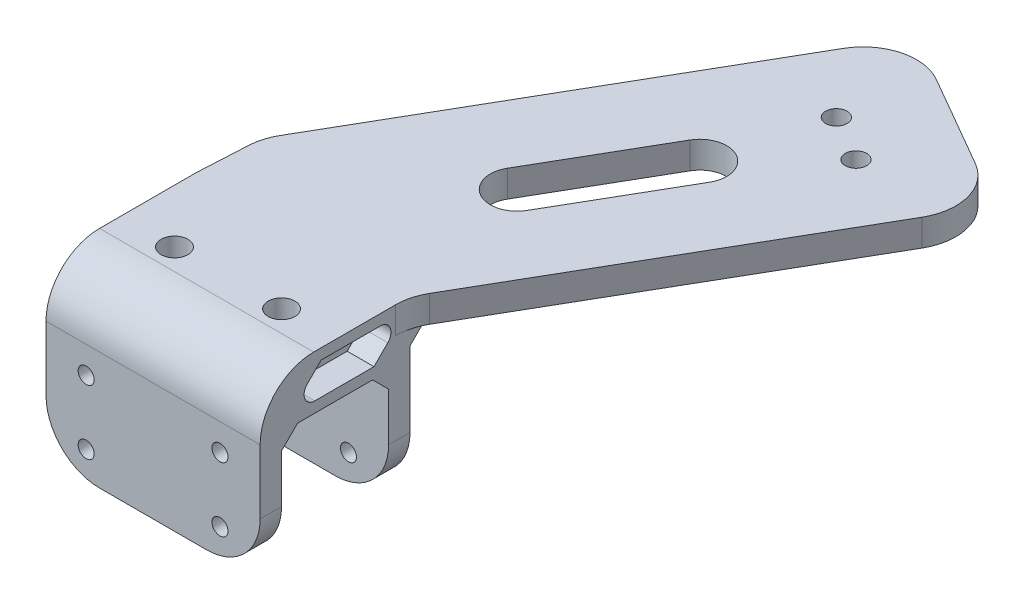
from build123d import *

# Parameters (mm, degrees)
EXTRUDE_1_DEPTH      = 10
SKETCH_2_W           = 40
SKETCH_2_H           = 4
SKETCH_2_H_2         = 3.9999999999999982
EXTRUDE_2_DEPTH      = 10
SKETCH_4_W           = 40
SKETCH_4_H           = 5
EXTRUDE_3_DEPTH      = 15
SKETCH_6_W           = 40
SKETCH_6_H           = 5
EXTRUDE_4_DEPTH      = 15
SKETCH_8_R           = 2.5000000000000004
CUT_EXTRUDE_2_DEPTH  = 15
CHAMFER_1_SIZE       = 3
FILLET_1_R           = 10
CHAMFER_2_SIZE       = 3
SKETCH_9_R           = 1.5000000000000007
CUT_EXTRUDE_3_DEPTH  = 38.41657386773942
CUT_EXTRUDE_4_DEPTH  = 5
FILLET_3_R           = 2
SKETCH_11_W          = 40
SKETCH_11_H          = 6.999999999999998
SKETCH_11_H_2        = 7
EXTRUDE_5_DEPTH      = 3
CHAMFER_3_SIZE       = 1
SKETCH_12_W          = 40
SKETCH_12_H          = 5
EXTRUDE_6_DEPTH      = 30
FILLET_4_R           = 10
SKETCH_13_R          = 2
SKETCH_13_R_2        = 2.0000000000000027
CUT_EXTRUDE_5_DEPTH  = 30
EXTRUDE_START        = -5
EXTRUDE_7_DEPTH      = 5
CUT_EXTRUDE_6_DEPTH  = 5
SKETCH_16_W          = 20.000000000000007
SKETCH_16_H          = 9.517030698893077
CUT_EXTRUDE_7_DEPTH  = 122.15395545343927
SKETCH_17_W          = 40
SKETCH_17_H          = 3.9999999999999982
SKETCH_17_H_2        = 4
EXTRUDE_8_DEPTH      = 12
SKETCH_18_R          = 1.5000000000000007
SKETCH_18_R_2        = 1.5000000000000009
CUT_EXTRUDE_8_DEPTH  = 124.72425272933131
SKETCH_19_R          = 2.0000000000000067
SKETCH_19_R_2        = 2.0000000000000036
CUT_EXTRUDE_9_DEPTH  = 115.02754457592229
CUT_EXTRUDE_10_DEPTH = 115.02754457592229
EXTRUDE_9_DEPTH      = 5
SKETCH_23_R          = 2.0000000000000036
SKETCH_23_R_2        = 2.0000000000000067
CUT_EXTRUDE_11_DEPTH = 115.0275445759223
SKETCH_24_R          = 2.0000000000000067
SKETCH_24_R_2        = 2.0000000000000036
CUT_EXTRUDE_12_DEPTH = 115.02754457592229
CUT_EXTRUDE_13_DEPTH = 115.02754457592229
SKETCH_26_W          = 40
SKETCH_26_H          = 5
EXTRUDE_10_DEPTH     = 10
FILLET_6_R           = 10


with BuildPart() as part:
    # 草图1 → 凸台-拉伸1 (new body)
    with BuildSketch(Plane(origin=(0, 0, 0), x_dir=(1, 0, 0), z_dir=(0, 1, 0))):
        Polygon((20.000000000000004, 14.000000000000007), (-19.999999999999996, 14.000000000000002), (-19.999999999999996, -13.999999999999998), (20.000000000000004, -13.999999999999993), align=None)
    extrude(amount=EXTRUDE_1_DEPTH)

    # 草图2 → 凸台-拉伸2 (add)
    with BuildSketch(Plane.XZ):
        with Locations((3.55e-15, 11.999999999999998)):
            Rectangle(SKETCH_2_W, SKETCH_2_H)
        with Locations((3.55e-15, -12.000000000000007)):
            Rectangle(SKETCH_2_W, SKETCH_2_H_2)
    extrude(amount=EXTRUDE_2_DEPTH)

    # 草图4 → 凸台-拉伸3 (add)
    with BuildSketch(Plane(origin=(-1.82e-15, 0, -14.000000000000004), x_dir=(-1, 0, 1.3e-16), z_dir=(-1.3e-16, 0, -1))):
        with Locations((-7.11e-15, 7.5)):
            Rectangle(SKETCH_4_W, SKETCH_4_H)
    extrude(amount=EXTRUDE_3_DEPTH)

    # 草图6 → 凸台-拉伸4 (add)
    with BuildSketch(Plane(origin=(-3.77e-15, 0, -29.000000000000004), x_dir=(-1, 0, 1.3e-16), z_dir=(-1.3e-16, 0, -1))):
        with Locations((-3.55e-15, 7.5)):
            Rectangle(SKETCH_6_W, SKETCH_6_H)
    extrude(amount=EXTRUDE_4_DEPTH)

    # 草图8 → 切除-拉伸2 (cut)
    with BuildSketch(Plane(origin=(0, 10, 0), x_dir=(1, 0, 0), z_dir=(0, 1, 0))):
        with Locations(Location((-10.000000000000004, 1.73e-15, 0), (0, 0, 270))):
            Circle(SKETCH_8_R)
        with Locations(Location((10.000000000000002, 1.73e-15, 0), (0, 0, 270))):
            Circle(SKETCH_8_R)
    extrude(amount=-CUT_EXTRUDE_2_DEPTH, mode=Mode.SUBTRACT)

    # 倒角1
    chamfer_1_edges = [part.edges().sort_by_distance(p)[0] for p in [
        (3.55e-15, 0, 9.999999999999998),
        (3.55e-15, 0, -10.000000000000007),
    ]]
    chamfer(chamfer_1_edges, length=CHAMFER_1_SIZE)

    # 圆角1
    fillet_1_edges = [part.edges().sort_by_distance(p)[0] for p in [
        (3.55e-15, 10, 13.999999999999996),
    ]]
    fillet(fillet_1_edges, radius=FILLET_1_R)

    # 倒角2
    chamfer_2_edges = [part.edges().sort_by_distance(p)[0] for p in [
        (5.28e-15, 5, -14.000000000000004),
    ]]
    chamfer(chamfer_2_edges, length=CHAMFER_2_SIZE)

    # 草图9 → 切除-拉伸3 (cut, through all)
    with BuildSketch(Plane(origin=(-1.82e-15, 0, -14.000000000000004), x_dir=(-1, 0, 1.3e-16), z_dir=(-1.3e-16, 0, -1))):
        with Locations((-12.500000000000007, -5)):
            Circle(SKETCH_9_R)
        with Locations((12.499999999999993, -5)):
            Circle(SKETCH_9_R)
    extrude(amount=-CUT_EXTRUDE_3_DEPTH, mode=Mode.SUBTRACT)

    # 草图10 → 切除-拉伸4 (cut)
    with BuildSketch(Plane(origin=(20.000000000000004, 0, 0), x_dir=(0, 0, -1), z_dir=(1, 0, 0))):
        Polygon((-2.6185414170321746, 7.999999999999998), (-8.618541417032173, 2), (7.26407194166772, 2), (13.264071941667716, 8), align=None)
    cut_extrude_4 = extrude(amount=-CUT_EXTRUDE_4_DEPTH, mode=Mode.SUBTRACT)

    # 圆角3
    fillet_3_edges = [part.edges().sort_by_distance(p)[0] for p in [
        (17.500000000000004, 8, -13.264071941667716),
        (17.500000000000004, 2, 8.618541417032173),
    ]]
    fillet(fillet_3_edges, radius=FILLET_3_R)

    # 镜向1: 切除-拉伸4 across plane
    add(cut_extrude_4.mirror(Plane(origin=(0, 0, 0), x_dir=(0, 0, 1), z_dir=(1, 0, 0))), mode=Mode.SUBTRACT)

    # 草图11 → 凸台-拉伸5 (add)
    with BuildSketch(Plane.XZ.offset(10)):
        with Locations((3.55e-15, -10.500000000000007)):
            Rectangle(SKETCH_11_W, SKETCH_11_H)
        with Locations((3.55e-15, 10.499999999999998)):
            Rectangle(SKETCH_11_W, SKETCH_11_H_2)
    extrude(amount=-EXTRUDE_5_DEPTH)

    # 倒角3
    chamfer_3_edges = [part.edges().sort_by_distance(p)[0] for p in [
        (3.55e-15, -7, -7.000000000000007),
        (3.55e-15, -7, 6.999999999999998),
    ]]
    chamfer(chamfer_3_edges, length=CHAMFER_3_SIZE)

    # 草图12 → 凸台-拉伸6 (add)
    with BuildSketch(Plane(origin=(-7.63e-15, 0, -44.00000000000001), x_dir=(-1, 0, 1.7e-16), z_dir=(-1.7e-16, 0, -1))):
        with Locations((-3.55e-15, 7.5)):
            Rectangle(SKETCH_12_W, SKETCH_12_H)
    extrude(amount=EXTRUDE_6_DEPTH)

    # 圆角4
    fillet_4_edges = [part.edges().sort_by_distance(p)[0] for p in [
        (19.99999999999999, 7.5, -74),
        (-20.00000000000001, 7.5, -74),
    ]]
    fillet(fillet_4_edges, radius=FILLET_4_R)

    # 草图13 → 切除-拉伸5 (cut)
    with BuildSketch(Plane(origin=(0, 10, 0), x_dir=(1, 0, 0), z_dir=(0, 1, 0))):
        with Locations(Location((9.140000000000004, 70, 0), (0, 0, 270))):
            Circle(SKETCH_13_R)
        with Locations(Location((-0.8599999999999962, 70.00000000000001, 0), (0, 0, 270))):
            Circle(SKETCH_13_R_2)
    extrude(amount=-CUT_EXTRUDE_5_DEPTH, mode=Mode.SUBTRACT)

    # 草图14 → 凸台-拉伸7 (add)
    with BuildSketch(Plane(origin=(0, 10, 0), x_dir=(1, 0, 0), z_dir=(0, 1, 0)).offset(EXTRUDE_START)):
        with BuildLine():
            Line((-19.999999999999996, 64.00000000000001), (-19.999999999999996, 14.000000000000007))
            Line((-19.999999999999996, 14.000000000000007), (20.000000000000004, 14.000000000000007))
            Line((20.000000000000004, 14.000000000000007), (20.000000000000004, 24.71796769724495))
            Line((20.000000000000004, 24.717967697244944), (-8.452994616207512, 74.00000000000003))
            Line((-8.45299461620751, 74.00000000000001), (-9.999999999999998, 74.00000000000001))
            ThreePointArc((-9.999999999999998, 74.00000000000001), (-17.071067811865472, 71.07106781186549), (-19.999999999999996, 64.00000000000001))
        make_face()
        with BuildLine():
            Line((-55.00000000000003, 74.62177826491072), (-19.999999999999996, 14.000000000000007))
            Line((-19.999999999999996, 14.000000000000007), (-19.999999999999996, 64.00000000000001))
            ThreePointArc((-19.999999999999996, 64.00000000000001), (-17.071067811865472, 71.07106781186549), (-9.999999999999998, 74.00000000000001))
            Line((-9.999999999999998, 74.00000000000001), (-8.45299461620751, 74.00000000000001))
            Line((-8.452994616207512, 74.00000000000003), (-20.35898384862252, 94.62177826491077))
            Line((-20.35898384862252, 94.62177826491077), (-55.000000000000014, 74.62177826491072))
        make_face()
    extrude(amount=EXTRUDE_7_DEPTH)

    # 草图15 → 切除-拉伸6 (cut)
    with BuildSketch(Plane(origin=(0, 10, 0), x_dir=(1, 0, 0), z_dir=(0, 1, 0))):
        Polygon((-8.452994616207489, 74.00000000000001), (20.000000000000004, 24.717967697244916), (20.000000000000004, 77.52110183518307), align=None)
    extrude(amount=-CUT_EXTRUDE_6_DEPTH, mode=Mode.SUBTRACT)

    # 草图16 → 切除-拉伸7 (cut, through all)
    with BuildSketch(Plane(origin=(20.000000000000004, 0, 0), x_dir=(0, 0, -1), z_dir=(1, 0, 0))):
        with Locations((4.44e-15, -11.758515349446538)):
            Rectangle(SKETCH_16_W, SKETCH_16_H)
    extrude(amount=-CUT_EXTRUDE_7_DEPTH, mode=Mode.SUBTRACT)

    # 草图17 → 凸台-拉伸8 (add)
    with BuildSketch(Plane.XZ.offset(10)):
        with Locations((3.55e-15, -12.000000000000007)):
            Rectangle(SKETCH_17_W, SKETCH_17_H)
        with Locations((3.55e-15, 11.999999999999998)):
            Rectangle(SKETCH_17_W, SKETCH_17_H_2)
    extrude(amount=EXTRUDE_8_DEPTH)

    # 草图18 → 切除-拉伸8 (cut, through all)
    with BuildSketch(Plane.XY.offset(13.999999999999996)):
        with Locations(Location((-12.499999999999993, -5, 0), (0, 0, 180))):
            Circle(SKETCH_18_R)
        with Locations(Location((12.500000000000007, -5, 0), (0, 0, 180))):
            Circle(SKETCH_18_R)
        with Locations((12.500000000000007, -16.999999999999996)):
            Circle(SKETCH_18_R_2)
        with Locations((-12.499999999999993, -16.999999999999996)):
            Circle(SKETCH_18_R_2)
    extrude(amount=-CUT_EXTRUDE_8_DEPTH, mode=Mode.SUBTRACT)

    # 草图19 → 切除-拉伸9 (cut, through all)
    with BuildSketch(Plane(origin=(0, 10, 0), x_dir=(1, 0, 0), z_dir=(0, 1, 0))):
        with Locations(Location((-30.84936490538909, 82.79165124598856, 0), (0, 0, 270))):
            Circle(SKETCH_19_R)
        with Locations(Location((-39.509618943233484, 77.79165124598855, 0), (0, 0, 270))):
            Circle(SKETCH_19_R_2)
    extrude(amount=-CUT_EXTRUDE_9_DEPTH, mode=Mode.SUBTRACT)

    # 草图20 → 切除-拉伸10 (cut, through all)
    with BuildSketch(Plane(origin=(0, 10, 0), x_dir=(1, 0, 0), z_dir=(0, 1, 0))):
        with BuildLine():
            Line((-22.598956840337568, 65.9859096217943), (-11.740968079891154, 47.17932142068932))
            ThreePointArc((-11.740968079891154, 47.17932142068932), (-13.11070547769434, 42.067391859060635), (-18.22263503932303, 43.43712925686382))
            Line((-18.22263503932303, 43.43712925686382), (-29.080623799769445, 62.2437174579688))
            ThreePointArc((-29.080623799769445, 62.2437174579688), (-27.71088640196626, 67.35564701959748), (-22.598956840337568, 65.9859096217943))
        make_face()
    extrude(amount=-CUT_EXTRUDE_10_DEPTH, mode=Mode.SUBTRACT)

    # 草图22 → 凸台-拉伸9 (add)
    with BuildSketch(Plane(origin=(0, 10, 0), x_dir=(1, 0, 0), z_dir=(0, 1, 0))):
        Polygon((20.000000000000004, 24.717967697244916), (20.000000000000004, 14.000000000000005), (52.185853837740325, 69.74753413195232), (55.00000000000002, 74.62177826491073), (20.35898384862252, 94.62177826491079), (1.066e-14, 59.358983848622465), align=None)
    extrude(amount=-EXTRUDE_9_DEPTH)

    # 草图23 → 切除-拉伸11 (cut, through all)
    # profile 1 of 2: a face of its own
    with BuildSketch(Plane(origin=(0, 10, 0), x_dir=(1, 0, 0), z_dir=(0, 1, 0))):
        Polygon((-19.37046826566082, 25.80834864609737), (-3.47e-15, 59.35898384862246), (-20.35898384862252, 94.62177826491079), (-55.000000000000014, 74.62177826491073), (-23.09401076758504, 19.358983848622493), align=None)
        with BuildLine():
            ThreePointArc((-11.740968079891154, 47.17932142068932), (-13.110705477694344, 42.067391859060635), (-18.22263503932303, 43.43712925686382))
            Line((-18.22263503932303, 43.43712925686382), (-29.080623799769448, 62.24371745796881))
            ThreePointArc((-29.080623799769445, 62.24371745796881), (-27.710886401966246, 67.3556470195975), (-22.598956840337564, 65.9859096217943))
            Line((-22.598956840337568, 65.9859096217943), (-11.740968079891154, 47.17932142068932))
        make_face(mode=Mode.SUBTRACT)
        with Locations((-39.509618943233484, 77.79165124598855)):
            Circle(SKETCH_23_R, mode=Mode.SUBTRACT)
        with Locations((-30.84936490538909, 82.79165124598856)):
            Circle(SKETCH_23_R_2, mode=Mode.SUBTRACT)
    # profile 2 of 2: a face of its own
    with BuildSketch(Plane(origin=(0, 10, 0), x_dir=(1, 0, 0), z_dir=(0, 1, 0))):
        Polygon((-20, 14.00000000000002), (-19.370468265660815, 25.80834864609738), (-23.094010767585043, 19.358983848622486), align=None)
    extrude(amount=-CUT_EXTRUDE_11_DEPTH, mode=Mode.SUBTRACT)

    # 草图24 → 切除-拉伸12 (cut, through all)
    with BuildSketch(Plane(origin=(0, 10, 0), x_dir=(1, 0, 0), z_dir=(0, 1, 0))):
        with Locations(Location((30.849364905389077, 82.79165124598858, 0), (0, 0, 270))):
            Circle(SKETCH_24_R)
        with Locations(Location((39.50961894323347, 77.79165124598856, 0), (0, 0, 270))):
            Circle(SKETCH_24_R_2)
    extrude(amount=-CUT_EXTRUDE_12_DEPTH, mode=Mode.SUBTRACT)

    # 草图25 → 切除-拉伸13 (cut, through all)
    with BuildSketch(Plane(origin=(0, 10, 0), x_dir=(1, 0, 0), z_dir=(0, 1, 0))):
        with BuildLine():
            Line((8.349364905389072, 43.82050807568882), (20.84936490538906, 65.47114317029978))
            ThreePointArc((20.84936490538906, 65.47114317029978), (27.679491924311264, 67.30127018922197), (29.509618943233452, 60.47114317029978))
            Line((29.509618943233452, 60.47114317029978), (17.00961894323346, 38.82050807568883))
            ThreePointArc((17.00961894323346, 38.82050807568883), (10.17949192431127, 36.99038105676664), (8.349364905389072, 43.82050807568882))
        make_face()
    extrude(amount=-CUT_EXTRUDE_13_DEPTH, mode=Mode.SUBTRACT)

    # 草图26 → 凸台-拉伸10 (add)
    with BuildSketch(Plane(origin=(46.06217782649125, 0, -79.78203230275507), x_dir=(-0.8660254037844378, 0, -0.5000000000000016), z_dir=(0.5000000000000016, 0, -0.8660254037844378))):
        with Locations((9.679491924311383, 7.5)):
            Rectangle(SKETCH_26_W, SKETCH_26_H)
    extrude(amount=EXTRUDE_10_DEPTH)

    # 圆角6
    fillet_6_edges = [part.edges().sort_by_distance(p)[0] for p in [
        (-19.999999999999996, -22, -12.000000000000007),
        (-19.999999999999996, -22, 11.999999999999998),
        (20.000000000000004, -22, 11.999999999999998),
        (20.000000000000004, -22, -12.000000000000007),
        (20.000000000000004, 7.5, -14.000000000000007),
        (-19.37046826566082, 7.5, -25.808348646097375),
        (25.358983848622543, 7.5, -103.28203230275518),
        (60.00000000000005, 7.5, -83.28203230275513),
    ]]
    fillet(fillet_6_edges, radius=FILLET_6_R)


solid = part.part
